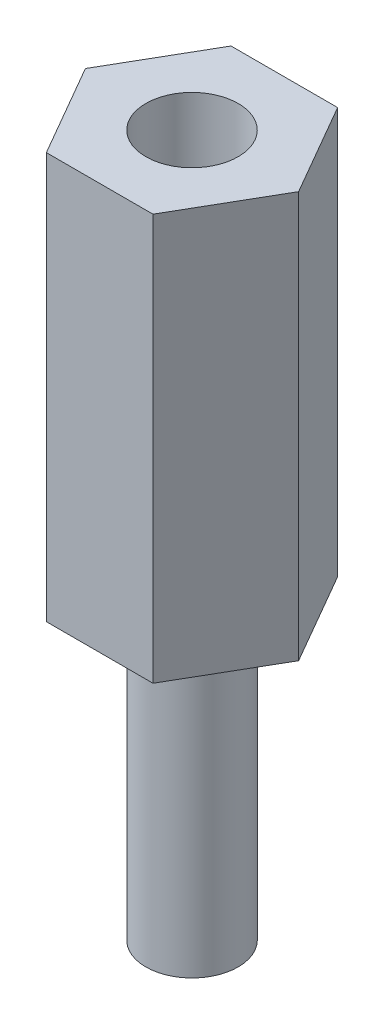
from build123d import *

# Parameters (mm, degrees)
SKETCH1_R                = 1.25
BOSS_EXTRUDE1_DEPTH      = 11
BOSS_EXTRUDE2_DEPTH      = 2
BOSS_EXTRUDE2_DEPTH_BACK = 8
SKETCH1_2_R              = 1.25


with BuildPart() as part:
    # Sketch1 → Boss-Extrude1 (new body)
    with BuildSketch(Plane(origin=(0, 0, 0), x_dir=(1, 0, 0), z_dir=(0, 1, 0))):
        Polygon((-2.886751346, 0), (-1.443375673, -2.5), (1.443375673, -2.5), (2.886751346, 0), (1.443375673, 2.5), (-1.443375673, 2.5), align=None)
        Circle(SKETCH1_R, mode=Mode.SUBTRACT)
    extrude(amount=BOSS_EXTRUDE1_DEPTH)

    # Sketch1<2> → Boss-Extrude2 (add, two sides: drawn at the far end of the back side and taken through both)
    with BuildSketch(Plane(origin=(0, 0, 0), x_dir=(1, 0, 0), z_dir=(0, 1, 0)).offset(-BOSS_EXTRUDE2_DEPTH_BACK)):
        Circle(SKETCH1_2_R)
    extrude(amount=BOSS_EXTRUDE2_DEPTH + BOSS_EXTRUDE2_DEPTH_BACK)


solid = part.part
